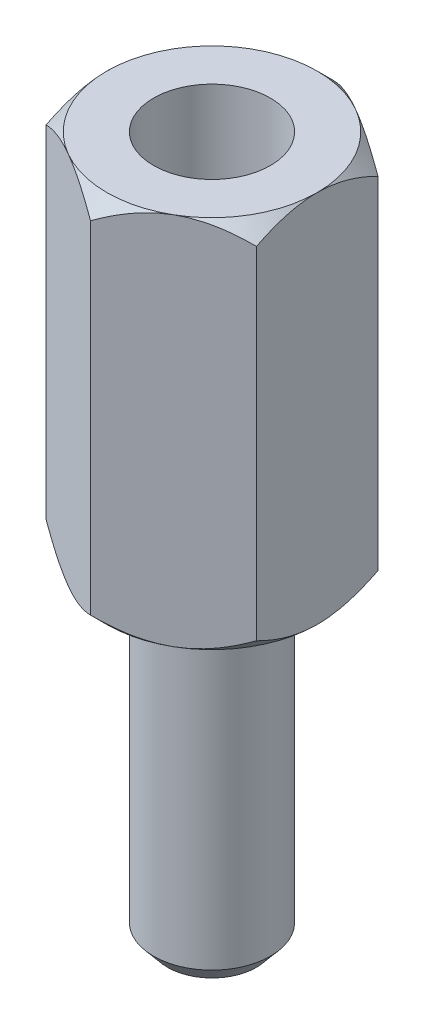
from build123d import *

# Parameters (mm, degrees)
SKETCH1_R           = 1.25
BOSS_EXTRUDE1_DEPTH = 7
BOSS_EXTRUDE2_DEPTH = 8
CUT_EXTRUDE1_START  = -4.8
SKETCH3_R           = 1.25
CUT_EXTRUDE1_DEPTH  = 4.8
SKETCH4_OUTSIDE_W   = 42.578
SKETCH4_OUTSIDE_H   = 43.274
SKETCH4_OUTSIDE_R   = 2.25
CUT_EXTRUDE2_DEPTH  = 16.388713397
CUT_EXTRUDE2_DRAFT  = -45
SKETCH5_OUTSIDE_W   = 29.214
SKETCH5_OUTSIDE_H   = 29.91
SKETCH5_OUTSIDE_R   = 2.250008244
CUT_EXTRUDE3_DEPTH  = 9.707037384
CUT_EXTRUDE3_DRAFT  = -45
CHAMFER1_SIZE       = 0.3
CHAMFER1_SIZE2      = 0.357526078


with BuildPart() as part:
    # Sketch1 → Boss-Extrude1 (new body)
    with BuildSketch(Plane(origin=(0, 0, 0), x_dir=(1, 0, 0), z_dir=(0, 1, 0))):
        with Locations(Location((0, 0, 0), (0, 0, 270))):
            Circle(SKETCH1_R)
    extrude(amount=BOSS_EXTRUDE1_DEPTH)

    # Sketch2 → Boss-Extrude2 (add)
    with BuildSketch(Plane(origin=(0, 7, 0), x_dir=(1, 0, 0), z_dir=(0, 1, 0))):
        Polygon((0, 2.598076211), (-2.25, 1.299038106), (-2.25, -1.299038106), (0, -2.598076211), (2.25, -1.299038106), (2.25, 1.299038106), align=None)
    extrude(amount=BOSS_EXTRUDE2_DEPTH)

    # Sketch3 → Cut-Extrude1 (cut)
    with BuildSketch(Plane(origin=(0, 15, 0), x_dir=(1, 0, 0), z_dir=(0, 1, 0)).offset(CUT_EXTRUDE1_START)):
        with Locations(Location((0, 0, 0), (0, 0, 270))):
            Circle(SKETCH3_R)
    extrude(amount=CUT_EXTRUDE1_DEPTH, mode=Mode.SUBTRACT)


with BuildPart() as cut_extrude2_tool:
    # Sketch4 outside → Cut-Extrude2 (with draft: the straight prism first)
    with BuildSketch(Plane(origin=(0, 15, 0), x_dir=(1, 0, 0), z_dir=(0, 1, 0))):
        Rectangle(SKETCH4_OUTSIDE_W, SKETCH4_OUTSIDE_H)
        Circle(SKETCH4_OUTSIDE_R, mode=Mode.SUBTRACT)
    extrude(amount=-CUT_EXTRUDE2_DEPTH)
    # Cut-Extrude2: the draft: its side faces are tilted about the plane it starts from
    cut_extrude2_sides = [cut_extrude2_tool.faces().sort_by_distance(p)[0] for p in [
        (0, 6.805643302, 21.637),
        (21.289, 6.805643302, 0),
        (0, 6.805643302, -21.637),
        (-21.289, 6.805643302, 0),
        (-2.25, 6.805643302, 0),
    ]]
    draft(cut_extrude2_sides, Plane(origin=(0, 15, 0), x_dir=(1, 0, 0), z_dir=(0, 1, 0)), CUT_EXTRUDE2_DRAFT)


with BuildPart() as part_1:
    add(part.part)

    # Cut-Extrude2: cut by cut_extrude2_tool
    add(cut_extrude2_tool.part, mode=Mode.SUBTRACT)


with BuildPart() as cut_extrude3_tool:
    # Sketch5 outside → Cut-Extrude3 (with draft: the straight prism first)
    with BuildSketch(Plane.XZ.offset(-7)):
        Rectangle(SKETCH5_OUTSIDE_W, SKETCH5_OUTSIDE_H)
        Circle(SKETCH5_OUTSIDE_R, mode=Mode.SUBTRACT)
    extrude(amount=-CUT_EXTRUDE3_DEPTH)
    # Cut-Extrude3: the draft: its side faces are tilted about the plane it starts from
    cut_extrude3_sides = [cut_extrude3_tool.faces().sort_by_distance(p)[0] for p in [
        (0, 11.853518692, -14.955),
        (14.607, 11.853518692, 0),
        (0, 11.853518692, 14.955),
        (-14.607, 11.853518692, 0),
        (-2.250008244, 11.853518692, 0),
    ]]
    draft(cut_extrude3_sides, Plane.XZ.offset(-7), CUT_EXTRUDE3_DRAFT)


with BuildPart() as part_2:
    add(part_1.part)

    # Cut-Extrude3: cut by cut_extrude3_tool
    add(cut_extrude3_tool.part, mode=Mode.SUBTRACT)

    # Chamfer1
    chamfer1_edges = [part_2.edges().sort_by_distance(p)[0] for p in [
        (0, 0, -1.25),
    ]]
    chamfer1_side = [part_2.faces().sort_by_distance(p)[0] for p in [
        (0, 0, 0),
    ]]
    chamfer(chamfer1_edges, length=CHAMFER1_SIZE, length2=CHAMFER1_SIZE2, reference=chamfer1_side[0])


solid = part_2.part
